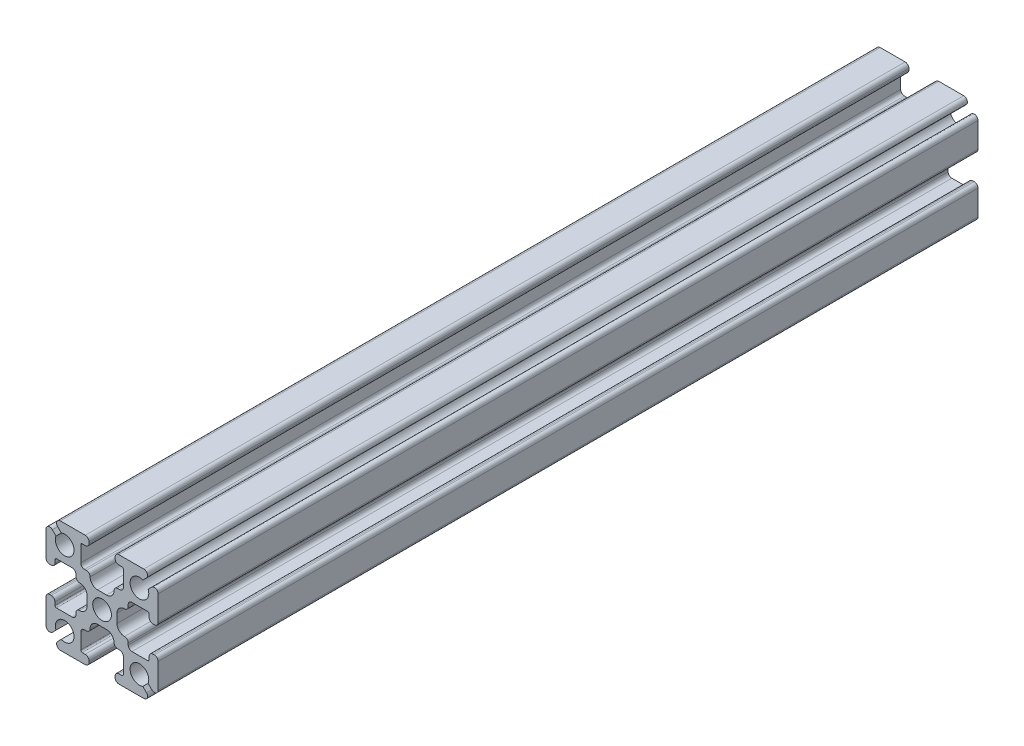
from build123d import *

# Parameters (mm, degrees)
SKETCH1_R           = 1.25
BOSS_EXTRUDE1_DEPTH = 109.700000056


with BuildPart() as part:
    # Sketch1 → Boss-Extrude1 (new body)
    with BuildSketch(Plane.XY):
        with BuildLine():
            Line((6.646446609, 5.939339828), (6.163645978, 5.456539197))
            ThreePointArc((6.163645978, 5.456539197), (4.116116524, 4.116116524), (5.456539197, 6.163645978))
            Line((5.456539197, 6.163645978), (5.939339828, 6.646446609))
            ThreePointArc((5.939339828, 6.646446609), (6.047726204, 7.191341716), (5.585786438, 7.5))
            Line((5.585786438, 7.5), (2.25, 7.5))
            ThreePointArc((2.25, 7.5), (1.896446609, 7.353553391), (1.75, 7))
            Line((1.75, 7), (1.75, 6.8))
            ThreePointArc((1.75, 6.8), (1.896446609, 6.446446609), (2.25, 6.3))
            Line((2.25, 6.3), (2.65, 6.3))
            ThreePointArc((2.65, 6.3), (2.791421356, 6.241421356), (2.85, 6.1))
            Line((2.85, 6.1), (2.85, 4))
            ThreePointArc((2.85, 4), (2.703553391, 3.646446609), (2.35, 3.5))
            Line((2.35, 3.5), (2.1, 3.5))
            ThreePointArc((2.1, 3.5), (1.746446609, 3.353553391), (1.6, 3))
            ThreePointArc((1.6, 3), (1.307106781, 2.292893219), (0.6, 2))
            Line((0.6, 2), (-0.6, 2))
            ThreePointArc((-0.6, 2), (-1.307106781, 2.292893219), (-1.6, 3))
            ThreePointArc((-1.6, 3), (-1.746446609, 3.353553391), (-2.1, 3.5))
            Line((-2.1, 3.5), (-2.35, 3.5))
            ThreePointArc((-2.35, 3.5), (-2.703553391, 3.646446609), (-2.85, 4))
            Line((-2.85, 4), (-2.85, 6.1))
            ThreePointArc((-2.85, 6.1), (-2.791421356, 6.241421356), (-2.65, 6.3))
            Line((-2.65, 6.3), (-2.25, 6.3))
            ThreePointArc((-2.25, 6.3), (-1.896446609, 6.446446609), (-1.75, 6.8))
            Line((-1.75, 6.8), (-1.75, 7))
            ThreePointArc((-1.75, 7), (-1.896446609, 7.353553391), (-2.25, 7.5))
            Line((-2.25, 7.5), (-5.585786438, 7.5))
            ThreePointArc((-5.585786438, 7.5), (-6.047726204, 7.191341716), (-5.939339828, 6.646446609))
            Line((-5.939339828, 6.646446609), (-5.456539197, 6.163645978))
            ThreePointArc((-5.456539197, 6.163645978), (-4.116116524, 4.116116524), (-6.163645978, 5.456539197))
            Line((-6.163645978, 5.456539197), (-6.646446609, 5.939339828))
            ThreePointArc((-6.646446609, 5.939339828), (-7.191341716, 6.047726204), (-7.5, 5.585786438))
            Line((-7.5, 5.585786438), (-7.5, 2.25))
            ThreePointArc((-7.5, 2.25), (-7.353553391, 1.896446609), (-7, 1.75))
            Line((-7, 1.75), (-6.8, 1.75))
            ThreePointArc((-6.8, 1.75), (-6.446446609, 1.896446609), (-6.3, 2.25))
            Line((-6.3, 2.25), (-6.3, 2.65))
            ThreePointArc((-6.3, 2.65), (-6.241421356, 2.791421356), (-6.1, 2.85))
            Line((-6.1, 2.85), (-4, 2.85))
            ThreePointArc((-4, 2.85), (-3.646446609, 2.703553391), (-3.5, 2.35))
            Line((-3.5, 2.35), (-3.5, 2.1))
            ThreePointArc((-3.5, 2.1), (-3.353553391, 1.746446609), (-3, 1.6))
            ThreePointArc((-3, 1.6), (-2.292893219, 1.307106781), (-2, 0.6))
            Line((-2, 0.6), (-2, -0.6))
            ThreePointArc((-2, -0.6), (-2.292893219, -1.307106781), (-3, -1.6))
            ThreePointArc((-3, -1.6), (-3.353553391, -1.746446609), (-3.5, -2.1))
            Line((-3.5, -2.1), (-3.5, -2.35))
            ThreePointArc((-3.5, -2.35), (-3.646446609, -2.703553391), (-4, -2.85))
            Line((-4, -2.85), (-6.1, -2.85))
            ThreePointArc((-6.1, -2.85), (-6.241421356, -2.791421356), (-6.3, -2.65))
            Line((-6.3, -2.65), (-6.3, -2.25))
            ThreePointArc((-6.3, -2.25), (-6.446446609, -1.896446609), (-6.8, -1.75))
            Line((-6.8, -1.75), (-7, -1.75))
            ThreePointArc((-7, -1.75), (-7.353553391, -1.896446609), (-7.5, -2.25))
            Line((-7.5, -2.25), (-7.5, -5.585786438))
            ThreePointArc((-7.5, -5.585786438), (-7.191341716, -6.047726204), (-6.646446609, -5.939339828))
            Line((-6.646446609, -5.939339828), (-6.163645978, -5.456539197))
            ThreePointArc((-6.163645978, -5.456539197), (-4.116116524, -4.116116524), (-5.456539197, -6.163645978))
            Line((-5.456539197, -6.163645978), (-5.939339828, -6.646446609))
            ThreePointArc((-5.939339828, -6.646446609), (-6.047726204, -7.191341716), (-5.585786438, -7.5))
            Line((-5.585786438, -7.5), (-2.25, -7.5))
            ThreePointArc((-2.25, -7.5), (-1.896446609, -7.353553391), (-1.75, -7))
            Line((-1.75, -7), (-1.75, -6.8))
            ThreePointArc((-1.75, -6.8), (-1.896446609, -6.446446609), (-2.25, -6.3))
            Line((-2.25, -6.3), (-2.65, -6.3))
            ThreePointArc((-2.65, -6.3), (-2.791421356, -6.241421356), (-2.85, -6.1))
            Line((-2.85, -6.1), (-2.85, -4))
            ThreePointArc((-2.85, -4), (-2.703553391, -3.646446609), (-2.35, -3.5))
            Line((-2.35, -3.5), (-2.1, -3.5))
            ThreePointArc((-2.1, -3.5), (-1.746446609, -3.353553391), (-1.6, -3))
            ThreePointArc((-1.6, -3), (-1.307106781, -2.292893219), (-0.6, -2))
            Line((-0.6, -2), (0.6, -2))
            ThreePointArc((0.6, -2), (1.307106781, -2.292893219), (1.6, -3))
            ThreePointArc((1.6, -3), (1.746446609, -3.353553391), (2.1, -3.5))
            Line((2.1, -3.5), (2.35, -3.5))
            ThreePointArc((2.35, -3.5), (2.703553391, -3.646446609), (2.85, -4))
            Line((2.85, -4), (2.85, -6.1))
            ThreePointArc((2.85, -6.1), (2.791421356, -6.241421356), (2.65, -6.3))
            Line((2.65, -6.3), (2.25, -6.3))
            ThreePointArc((2.25, -6.3), (1.896446609, -6.446446609), (1.75, -6.8))
            Line((1.75, -6.8), (1.75, -7))
            ThreePointArc((1.75, -7), (1.896446609, -7.353553391), (2.25, -7.5))
            Line((2.25, -7.5), (5.585786438, -7.5))
            ThreePointArc((5.585786438, -7.5), (6.047726204, -7.191341716), (5.939339828, -6.646446609))
            Line((5.939339828, -6.646446609), (5.456539197, -6.163645978))
            ThreePointArc((5.456539197, -6.163645978), (4.116116524, -4.116116524), (6.163645978, -5.456539197))
            Line((6.163645978, -5.456539197), (6.646446609, -5.939339828))
            ThreePointArc((6.646446609, -5.939339828), (7.191341716, -6.047726204), (7.5, -5.585786438))
            Line((7.5, -5.585786438), (7.5, -2.25))
            ThreePointArc((7.5, -2.25), (7.353553391, -1.896446609), (7, -1.75))
            Line((7, -1.75), (6.8, -1.75))
            ThreePointArc((6.8, -1.75), (6.446446609, -1.896446609), (6.3, -2.25))
            Line((6.3, -2.25), (6.3, -2.65))
            ThreePointArc((6.3, -2.65), (6.241421356, -2.791421356), (6.1, -2.85))
            Line((6.1, -2.85), (4, -2.85))
            ThreePointArc((4, -2.85), (3.646446609, -2.703553391), (3.5, -2.35))
            Line((3.5, -2.35), (3.5, -2.1))
            ThreePointArc((3.5, -2.1), (3.353553391, -1.746446609), (3, -1.6))
            ThreePointArc((3, -1.6), (2.292893219, -1.307106781), (2, -0.6))
            Line((2, -0.6), (2, 0.6))
            ThreePointArc((2, 0.6), (2.292893219, 1.307106781), (3, 1.6))
            ThreePointArc((3, 1.6), (3.353553391, 1.746446609), (3.5, 2.1))
            Line((3.5, 2.1), (3.5, 2.35))
            ThreePointArc((3.5, 2.35), (3.646446609, 2.703553391), (4, 2.85))
            Line((4, 2.85), (6.1, 2.85))
            ThreePointArc((6.1, 2.85), (6.241421356, 2.791421356), (6.3, 2.65))
            Line((6.3, 2.65), (6.3, 2.25))
            ThreePointArc((6.3, 2.25), (6.446446609, 1.896446609), (6.8, 1.75))
            Line((6.8, 1.75), (7, 1.75))
            ThreePointArc((7, 1.75), (7.353553391, 1.896446609), (7.5, 2.25))
            Line((7.5, 2.25), (7.5, 5.585786438))
            ThreePointArc((7.5, 5.585786438), (7.191341716, 6.047726204), (6.646446609, 5.939339828))
        make_face()
        with Locations(Location((0, 0, 0), (0, 0, 180))):
            Circle(SKETCH1_R, mode=Mode.SUBTRACT)
    extrude(amount=BOSS_EXTRUDE1_DEPTH)


solid = part.part
